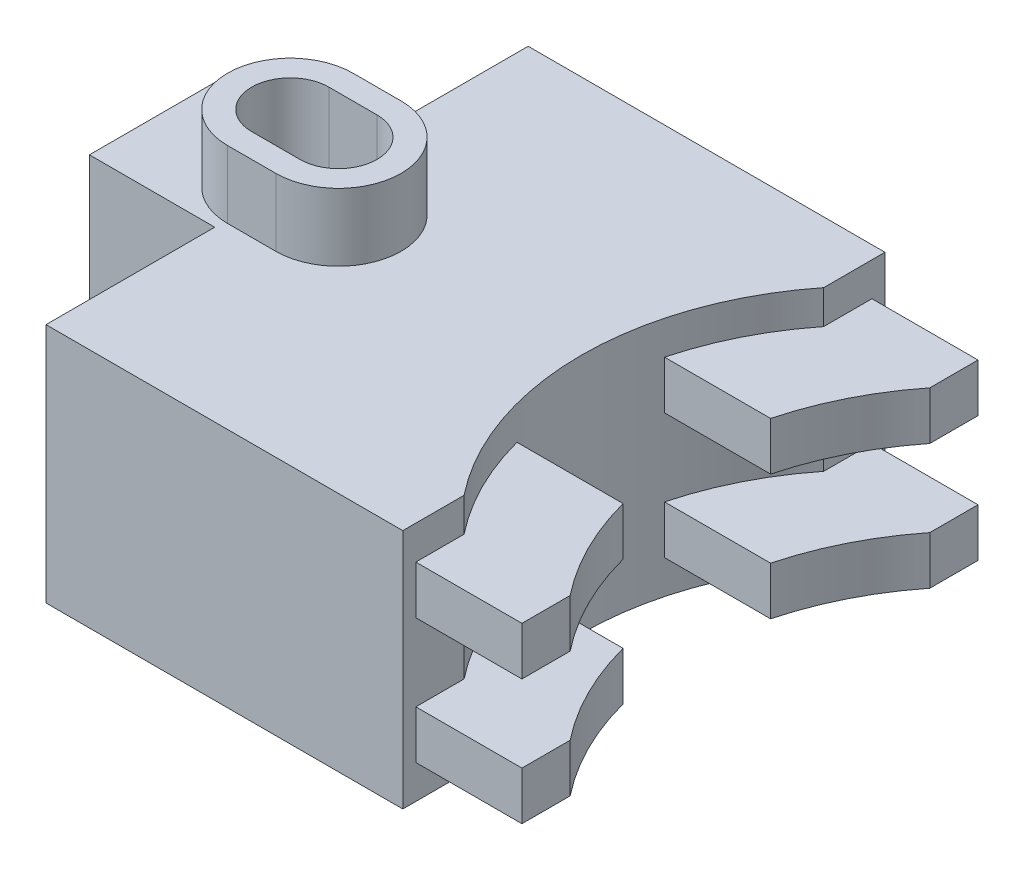
from build123d import *

# Parameters (mm, degrees)
EXTRUDE_1_DEPTH     = 12.5
EXTRUDE_START       = 5
EXTRUDE_3_DEPTH     = 5
EXTRUDE_4_DEPTH     = 7
EXTRUDE_START_2     = -45
EXTRUDE_5_DEPTH     = 45
CUT_EXTRUDE_1_DEPTH = 45


with BuildPart() as part:
    # 草图1 → 凸台-拉伸1 (new, symmetric)
    with BuildSketch(Plane(origin=(0, 0, 0), x_dir=(1, 0, 0), z_dir=(0, 1, 0))):
        with BuildLine():
            Line((18.5, 18.648056199), (18.5, 25))
            Line((18.5, 25), (-18.5, 25))
            Line((-18.5, 25), (-18.5, 7.5))
            Line((-18.5, 7.5), (-31.5, 7.5))
            Line((-31.5, 7.5), (-31.5, -7.5))
            Line((-31.5, -7.5), (-18.5, -7.5))
            Line((-18.5, -7.5), (-18.5, -25))
            Line((-18.5, -25), (18.5, -25))
            Line((18.5, -25), (18.5, -18.648056199))
            ThreePointArc((18.5, -18.648056199), (12, 0), (18.5, 18.648056199))
        make_face()
    extrude(amount=EXTRUDE_1_DEPTH, both=True)

    # 草图2 → 凸台-拉伸3 (add)
    with BuildSketch(Plane(origin=(0, 4, 0), x_dir=(1, 0, 0), z_dir=(0, 1, 0)).offset(EXTRUDE_START)):
        with BuildLine():
            Line((18.5, 23.648056199), (29.5, 23.648056199))
            Line((29.5, 23.648056199), (29.5, 18.648056199))
            ThreePointArc((29.5, 18.648056199), (26.175718971, 13.433463712), (23.991255863, 7.648056199))
            Line((23.991255863, 7.648056199), (12.991255863, 7.648056199))
            ThreePointArc((12.991255863, 7.648056199), (15.175718971, 13.433463712), (18.5, 18.648056199))
            Line((18.5, 18.648056199), (18.5, 23.648056199))
        make_face()
        with BuildLine():
            Line((12.991255863, -7.648056199), (23.991255863, -7.648056199))
            ThreePointArc((23.991255863, -7.648056199), (26.175718971, -13.433463712), (29.5, -18.648056199))
            Line((29.5, -18.648056199), (29.5, -23.648056199))
            Line((29.5, -23.648056199), (18.5, -23.648056199))
            Line((18.5, -23.648056199), (18.5, -18.648056199))
            ThreePointArc((18.5, -18.648056199), (15.175718971, -13.433463712), (12.991255863, -7.648056199))
        make_face()
    extrude_3 = extrude(amount=-EXTRUDE_3_DEPTH)

    # 镜向1: 凸台-拉伸3 across plane
    add(extrude_3.mirror(Plane.ZX))

    # 草图3 → 凸台-拉伸4 (add)
    with BuildSketch(Plane(origin=(0, 12.5, 0), x_dir=(1, 0, 0), z_dir=(0, 1, 0))):
        with BuildLine():
            Line((-13.170764362, 6.5), (-18.170764362, 6.5))
            ThreePointArc((-18.170764362, 6.5), (-24.670764362, 0), (-18.170764362, -6.5))
            Line((-18.170764362, -6.5), (-13.170764362, -6.5))
            ThreePointArc((-13.170764362, -6.5), (-6.670764362, 0), (-13.170764362, 6.5))
        make_face()
    extrude(amount=EXTRUDE_4_DEPTH)

    # 草图5 → 凸台-拉伸5 (add)
    with BuildSketch(Plane(origin=(0, 19.5, 0), x_dir=(1, 0, 0), z_dir=(0, 1, 0)).offset(EXTRUDE_START_2)):
        with BuildLine():
            Line((-18.170764362, 6.5), (-13.170764362, 6.5))
            ThreePointArc((-13.170764362, 6.5), (-6.670764362, 0), (-13.170764362, -6.5))
            Line((-13.170764362, -6.5), (-18.170764362, -6.5))
            ThreePointArc((-18.170764362, -6.5), (-24.670764362, 0), (-18.170764362, 6.5))
        make_face()
    extrude(amount=EXTRUDE_5_DEPTH)

    # 草图6 → 切除-拉伸1 (cut)
    with BuildSketch(Plane(origin=(0, 19.5, 0), x_dir=(1, 0, 0), z_dir=(0, 1, 0))):
        with BuildLine():
            Line((-18.170764362, 4), (-13.170764362, 4))
            ThreePointArc((-13.170764362, 4), (-9.170764362, 0), (-13.170764362, -4))
            Line((-13.170764362, -4), (-18.170764362, -4))
            ThreePointArc((-18.170764362, -4), (-22.170764362, 0), (-18.170764362, 4))
        make_face()
    extrude(amount=-CUT_EXTRUDE_1_DEPTH, mode=Mode.SUBTRACT)


solid = part.part
